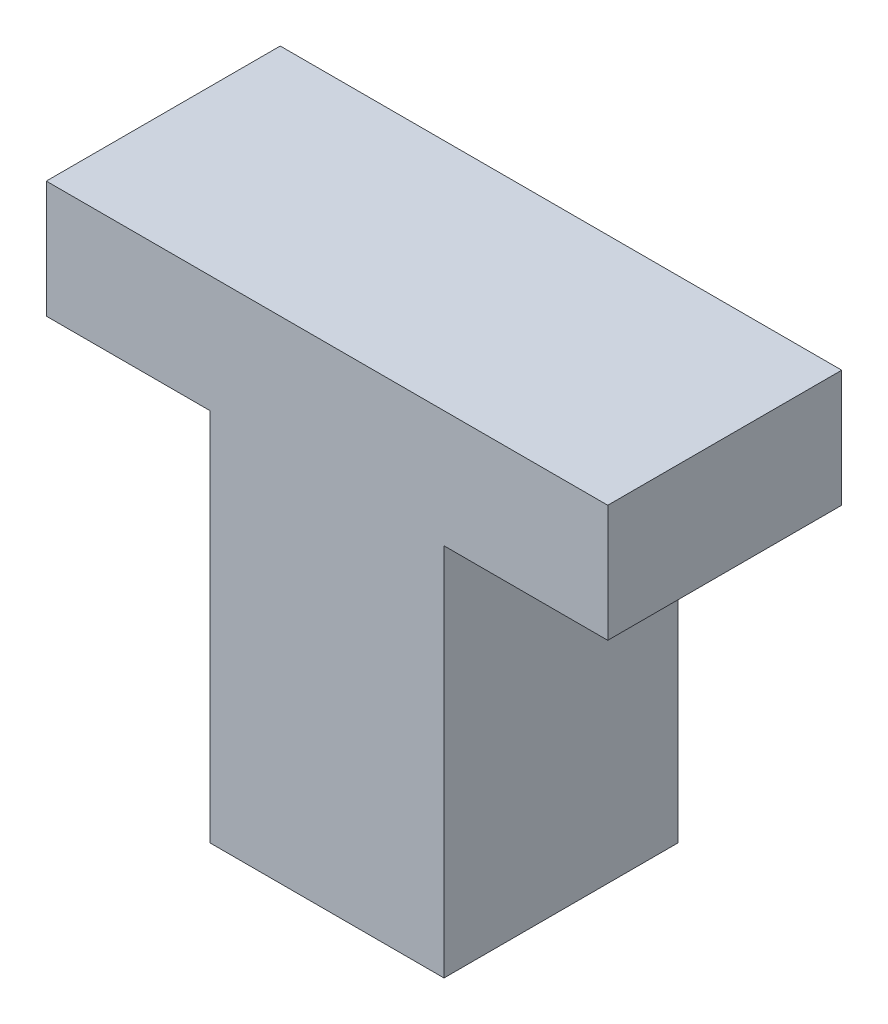
from build123d import *

# Parameters (mm, degrees)
BOSS_EXTRUDE1_DEPTH = 2.5


with BuildPart() as part:
    # Sketch1 → Boss-Extrude1 (new, symmetric)
    with BuildSketch(Plane.XY):
        Polygon((-2.5, 0), (2.5, 0), (2.5, 8), (6, 8), (6, 10.5), (-6, 10.5), (-6, 8), (-2.5, 8), align=None)
    extrude(amount=BOSS_EXTRUDE1_DEPTH, both=True)


solid = part.part
